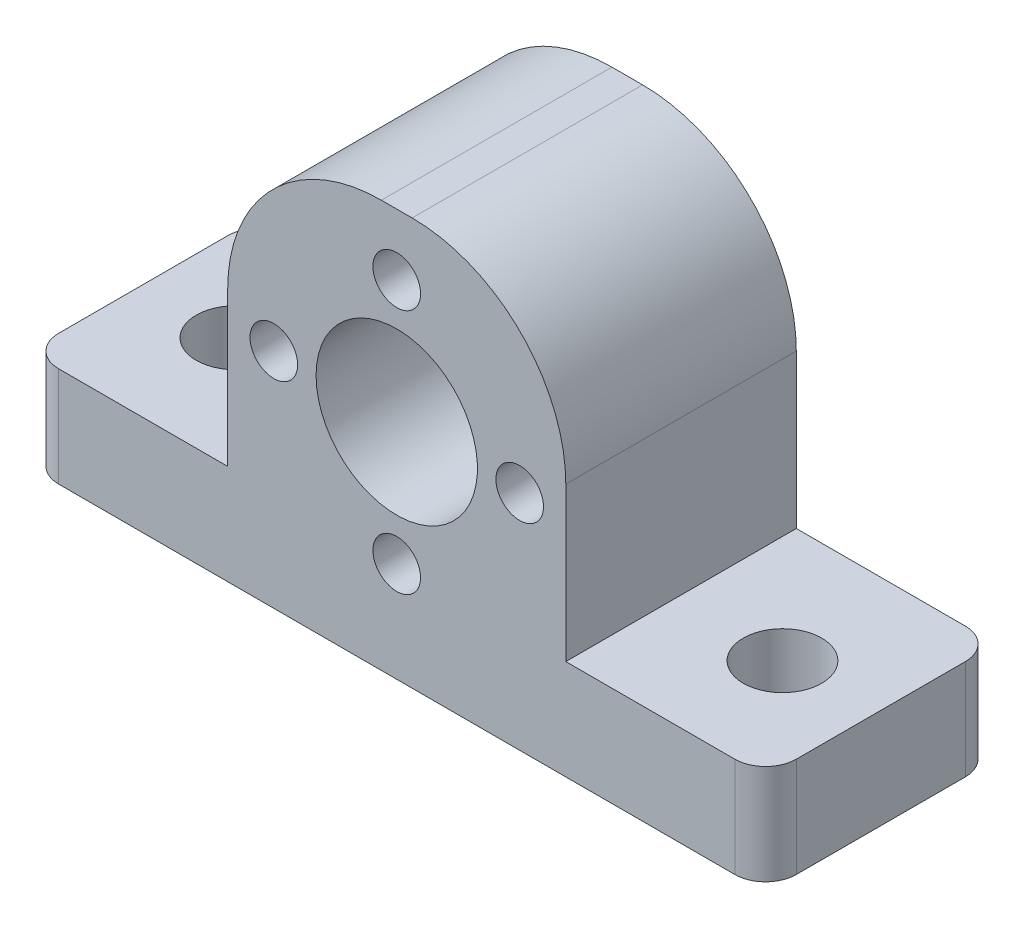
from build123d import *

# Parameters (mm, degrees)
SKETCH_1_W          = 48
SKETCH_1_H          = 15
EXTRUDE_1_DEPTH     = 6.5
SKETCH_2_W          = 22
SKETCH_2_H          = 15
EXTRUDE_2_DEPTH     = 20
FILLET_1_R          = 10
SKETCH_3_R          = 2.55
CUT_EXTRUDE_1_DEPTH = 34.700354834
SKETCH_4_R          = 5.25
SKETCH_4_R_2        = 1.55
CUT_EXTRUDE_2_DEPTH = 20
FILLET_2_R          = 2


with BuildPart() as part:
    # 草图1 → 凸台-拉伸1 (new body)
    with BuildSketch(Plane(origin=(0, 0, 0), x_dir=(1, 0, 0), z_dir=(0, 1, 0))):
        with Locations((-1.948504983, 0.398671096)):
            Rectangle(SKETCH_1_W, SKETCH_1_H)
    extrude(amount=EXTRUDE_1_DEPTH)

    # 草图2 → 凸台-拉伸2 (add)
    with BuildSketch(Plane(origin=(0, 6.5, 0), x_dir=(1, 0, 0), z_dir=(0, 1, 0))):
        with Locations((-1.948504983, 0.398671096)):
            Rectangle(SKETCH_2_W, SKETCH_2_H)
    extrude(amount=EXTRUDE_2_DEPTH)

    # 圆角1
    fillet_1_edges = [part.edges().sort_by_distance(p)[0] for p in [
        (-12.948504983, 26.5, -0.398671096),
        (9.051495017, 26.5, -0.398671096),
    ]]
    fillet(fillet_1_edges, radius=FILLET_1_R)

    # 草图3 → 切除-拉伸1 (cut, through all)
    with BuildSketch(Plane(origin=(0, 6.5, 0), x_dir=(1, 0, 0), z_dir=(0, 1, 0))):
        with Locations(Location((-19.948504983, 0.398671096, 0), (0, 0, 270))):
            Circle(SKETCH_3_R)
        with Locations(Location((16.051495017, 0, 0), (0, 0, 270))):
            Circle(SKETCH_3_R)
    extrude(amount=-CUT_EXTRUDE_1_DEPTH, mode=Mode.SUBTRACT)

    # 草图4 → 切除-拉伸2 (cut)
    with BuildSketch(Plane(origin=(0, 0, -7.898671096), x_dir=(-1, 0, 0), z_dir=(0, 0, -1))):
        with Locations((1.948504983, 14.5)):
            Circle(SKETCH_4_R)
        with Locations((1.948504983, 22.5)):
            Circle(SKETCH_4_R_2)
        with Locations((9.948504983, 14.5)):
            Circle(SKETCH_4_R_2)
        with Locations((1.948504983, 6.5)):
            Circle(SKETCH_4_R_2)
        with Locations((-6.051495017, 14.5)):
            Circle(SKETCH_4_R_2)
    extrude(amount=-CUT_EXTRUDE_2_DEPTH, mode=Mode.SUBTRACT)

    # 圆角2
    fillet_2_edges = [part.edges().sort_by_distance(p)[0] for p in [
        (-25.948504983, 3.25, -7.898671096),
        (22.051495017, 3.25, -7.898671096),
        (22.051495017, 3.25, 7.101328904),
        (-25.948504983, 3.25, 7.101328904),
    ]]
    fillet(fillet_2_edges, radius=FILLET_2_R)


solid = part.part
